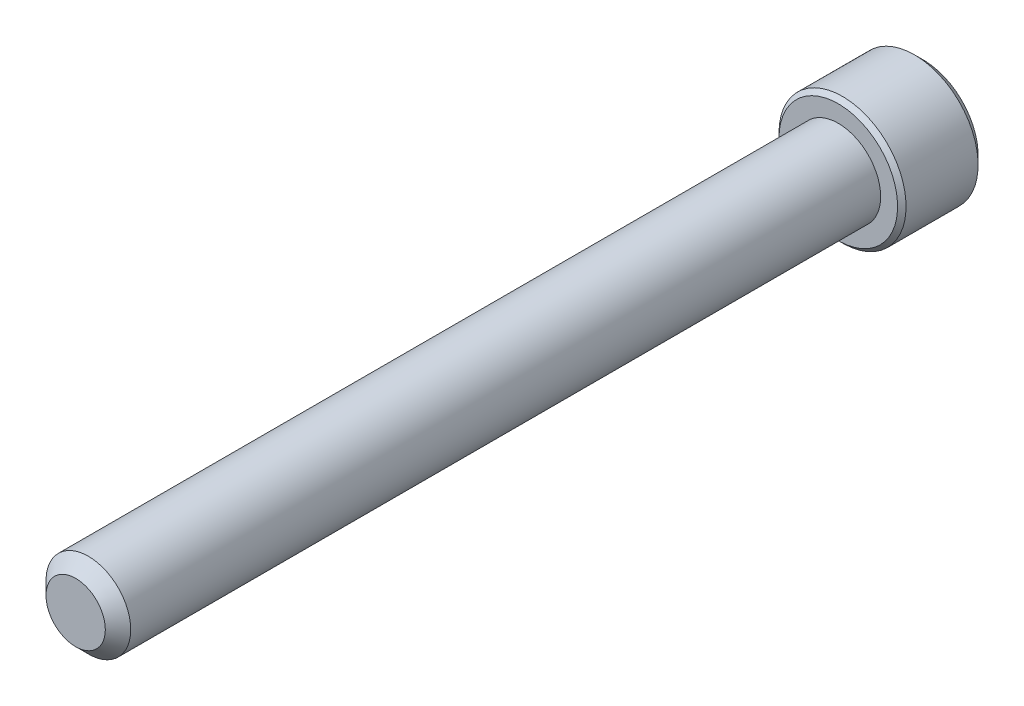
from build123d import *

# Parameters (mm, degrees)
SKETCH1_R          = 3.175
EXTRUDE1_DEPTH     = 57.15
CHAMFER3_SIZE      = 0.9525
SKETCH6_R          = 4.7625
EXTRUDE2_DEPTH     = 6.35
CUT_EXTRUDE1_DEPTH = 3.571875
SKETCH8_R          = 2.749630657
CUT_EXTRUDE2_DEPTH = 0.635
CUT_EXTRUDE2_DRAFT = -45
CHAMFER1_SIZE      = 0.635
CHAMFER2_SIZE      = 0.3175


with BuildPart() as part:
    # Sketch1 → Extrude1 (new body)
    with BuildSketch(Plane.XY):
        Circle(SKETCH1_R)
    extrude(amount=-EXTRUDE1_DEPTH)

    # Chamfer3
    chamfer3_edges = [part.edges().sort_by_distance(p)[0] for p in [
        (-3.175, 0, 0),
    ]]
    chamfer(chamfer3_edges, length=CHAMFER3_SIZE)

    # Sketch5 → partially thread (revolve)
    with BuildSketch(Plane(origin=(0, 0, 0), x_dir=(0, 0, -1), z_dir=(1, 0, 0))):
        Polygon((57.15, 3.175), (25.4, 3.175), (22.225, 0), (25.4, 0), (57.15, 0), align=None)
    revolve(axis=Axis((0, 0, 0), (0, 0, -1)))

    # Sketch6 → Extrude2 (add)
    with BuildSketch(Plane(origin=(0, 0, -57.15), x_dir=(-1, 0, 0), z_dir=(0, 0, -1))):
        Circle(SKETCH6_R)
    extrude(amount=EXTRUDE2_DEPTH)

    # Sketch7 → Cut-Extrude1 (cut)
    with BuildSketch(Plane(origin=(0, 0, -63.5), x_dir=(-1, 0, 0), z_dir=(0, 0, -1))):
        Polygon((0, 2.749630657), (-2.38125, 1.374815329), (-2.38125, -1.374815329), (0, -2.749630657), (2.38125, -1.374815329), (2.38125, 1.374815329), align=None)
    extrude(amount=-CUT_EXTRUDE1_DEPTH, mode=Mode.SUBTRACT)


with BuildPart() as cut_extrude2_tool:
    # Sketch8 → Cut-Extrude2 (with draft: the straight prism first)
    with BuildSketch(Plane(origin=(0, 0, -63.5), x_dir=(-1, 0, 0), z_dir=(0, 0, -1))):
        Circle(SKETCH8_R)
    extrude(amount=-CUT_EXTRUDE2_DEPTH)
    # Cut-Extrude2: the draft: its side faces are tilted about the plane it starts from
    cut_extrude2_sides = [cut_extrude2_tool.faces().sort_by_distance(p)[0] for p in [
        (2.749630657, 0, -63.1825),
    ]]
    draft(cut_extrude2_sides, Plane(origin=(0, 0, -63.5), x_dir=(-1, 0, 0), z_dir=(0, 0, -1)), CUT_EXTRUDE2_DRAFT)


with BuildPart() as part_1:
    add(part.part)

    # Cut-Extrude2: cut by cut_extrude2_tool
    add(cut_extrude2_tool.part, mode=Mode.SUBTRACT)

    # Chamfer1
    chamfer1_edges = [part_1.edges().sort_by_distance(p)[0] for p in [
        (4.7625, 0, -63.5),
    ]]
    chamfer(chamfer1_edges, length=CHAMFER1_SIZE)

    # Chamfer2
    chamfer2_edges = [part_1.edges().sort_by_distance(p)[0] for p in [
        (4.7625, 0, -57.15),
    ]]
    chamfer(chamfer2_edges, length=CHAMFER2_SIZE)


solid = part_1.part
